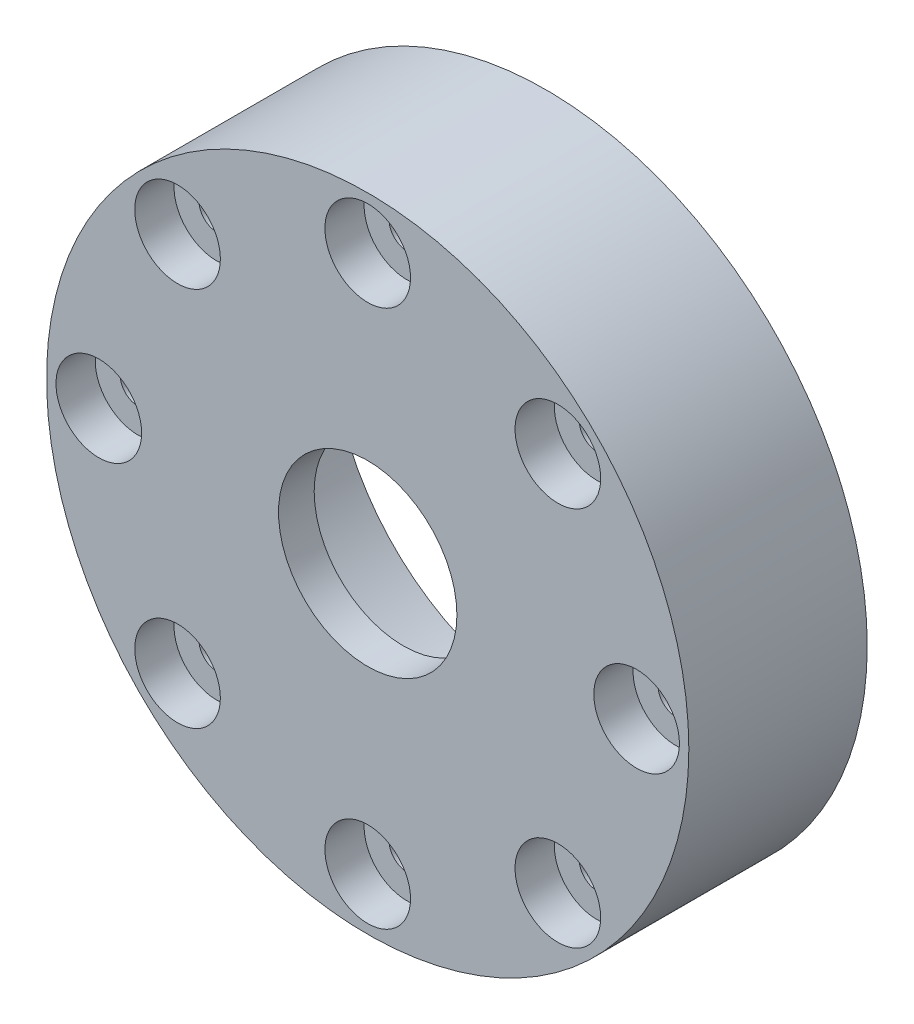
from build123d import *

# Parameters (mm, degrees)
SKETCH_1_R          = 45
EXTRUDE_1_DEPTH     = 25
SKETCH_2_R          = 12.5
CUT_EXTRUDE_2_DEPTH = 69.373971656
SKETCH_3_R          = 30
CUT_EXTRUDE_3_DEPTH = 20
SKETCH_4_R          = 2.5
CUT_EXTRUDE_4_DEPTH = 69.373971656
SKETCH_6_R          = 6
CUT_EXTRUDE_5_DEPTH = 5.5


with BuildPart() as part:
    # Эскиз1 → Вытянуть1 (new body)
    with BuildSketch(Plane.XY):
        Circle(SKETCH_1_R)
    extrude(amount=EXTRUDE_1_DEPTH)

    # Эскиз2 → Вытянуть2 (cut, through all)
    with BuildSketch(Plane.XY.offset(25)):
        Circle(SKETCH_2_R)
    extrude(amount=-CUT_EXTRUDE_2_DEPTH, mode=Mode.SUBTRACT)

    # Эскиз3 → Вытянуть3 (cut)
    with BuildSketch(Plane(origin=(0, 0, 0), x_dir=(-1, 0, 0), z_dir=(0, 0, -1))):
        Circle(SKETCH_3_R)
    extrude(amount=-CUT_EXTRUDE_3_DEPTH, mode=Mode.SUBTRACT)

    # Эскиз4 → Вытянуть4 (cut, through all)
    with BuildSketch(Plane.XY.offset(25)):
        with Locations((0, 37.683516186)):
            Circle(SKETCH_4_R)
        with Locations((26.646269834, 26.646269834)):
            Circle(SKETCH_4_R)
        with Locations((37.683516186, 0)):
            Circle(SKETCH_4_R)
        with Locations((26.646269834, -26.646269834)):
            Circle(SKETCH_4_R)
        with Locations((0, -37.683516186)):
            Circle(SKETCH_4_R)
        with Locations((-26.646269834, -26.646269834)):
            Circle(SKETCH_4_R)
        with Locations((-37.683516186, 0)):
            Circle(SKETCH_4_R)
        with Locations((-26.646269834, 26.646269834)):
            Circle(SKETCH_4_R)
    extrude(amount=-CUT_EXTRUDE_4_DEPTH, mode=Mode.SUBTRACT)

    # Эскиз6 → Вытянуть5 (cut)
    with BuildSketch(Plane.XY.offset(25)):
        with Locations((0, 37.683516186)):
            Circle(SKETCH_6_R)
        with Locations((26.646269834, 26.646269834)):
            Circle(SKETCH_6_R)
        with Locations((37.683516186, 0)):
            Circle(SKETCH_6_R)
        with Locations((26.646269834, -26.646269834)):
            Circle(SKETCH_6_R)
        with Locations((0, -37.683516186)):
            Circle(SKETCH_6_R)
        with Locations((-26.646269834, -26.646269834)):
            Circle(SKETCH_6_R)
        with Locations((-37.683516186, 0)):
            Circle(SKETCH_6_R)
        with Locations((-26.646269834, 26.646269834)):
            Circle(SKETCH_6_R)
    extrude(amount=-CUT_EXTRUDE_5_DEPTH, mode=Mode.SUBTRACT)


solid = part.part
